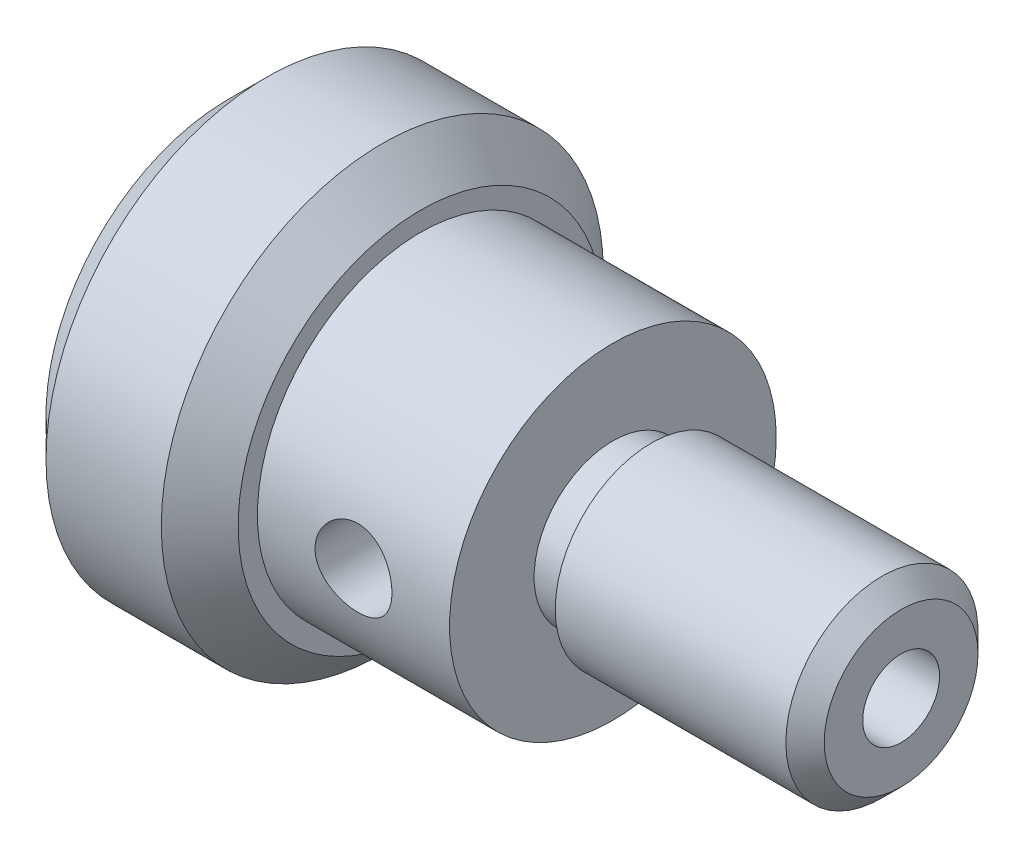
from build123d import *

# Parameters (mm, degrees)
SKETCH_1_R               = 11.5
EXTRUDE_1_DEPTH          = 10
CHAMFER_1_SIZE           = 2
CHAMFER_2_SIZE           = 2
SKETCH_2_R               = 8.5
EXTRUDE_2_DEPTH          = 10
SKETCH_3_R               = 4.1
EXTRUDE_3_DEPTH          = 2
SKETCH_4_R               = 5
EXTRUDE_4_DEPTH          = 13
CHAMFER_3_SIZE           = 1
CUT_EXTRUDE_1_DEPTH      = 39.594040991
CUT_EXTRUDE_1_DEPTH_BACK = 39.594040991
SKETCH_5_R               = 2
CUT_EXTRUDE_2_DEPTH      = 39.594040991
CUT_EXTRUDE_2_DEPTH_BACK = 23
SKETCH_6_R               = 2


with BuildPart() as part:
    # 草图1 → 凸台-拉伸1 (new body)
    with BuildSketch(Plane(origin=(0, 0, 0), x_dir=(0, 0, -1), z_dir=(1, 0, 0))):
        Circle(SKETCH_1_R)
    extrude(amount=EXTRUDE_1_DEPTH)

    # 倒角1
    chamfer_1_edges = [part.edges().sort_by_distance(p)[0] for p in [
        (0, 0, 11.5),
    ]]
    chamfer(chamfer_1_edges, length=CHAMFER_1_SIZE)

    # 倒角2
    chamfer_2_edges = [part.edges().sort_by_distance(p)[0] for p in [
        (10, 0, 11.5),
    ]]
    chamfer(chamfer_2_edges, length=CHAMFER_2_SIZE)

    # 草图2 → 凸台-拉伸2 (add)
    with BuildSketch(Plane(origin=(10, 0, 0), x_dir=(0, 0, -1), z_dir=(1, 0, 0))):
        Circle(SKETCH_2_R)
    extrude(amount=EXTRUDE_2_DEPTH)

    # 草图3 → 凸台-拉伸3 (add)
    with BuildSketch(Plane(origin=(20, 0, 0), x_dir=(0, 0, -1), z_dir=(1, 0, 0))):
        Circle(SKETCH_3_R)
    extrude(amount=EXTRUDE_3_DEPTH)

    # 草图4 → 凸台-拉伸4 (add)
    with BuildSketch(Plane(origin=(22, 0, 0), x_dir=(0, 0, -1), z_dir=(1, 0, 0))):
        Circle(SKETCH_4_R)
    extrude(amount=EXTRUDE_4_DEPTH)

    # 倒角3
    chamfer_3_edges = [part.edges().sort_by_distance(p)[0] for p in [
        (35, 0, 5),
    ]]
    chamfer(chamfer_3_edges, length=CHAMFER_3_SIZE)

    # 草图5 → 切除-拉伸1 (cut, two sides: drawn at the far end of the back side and taken through both)
    with BuildSketch(Plane.XY.offset(-CUT_EXTRUDE_1_DEPTH_BACK)):
        with Locations((15, 0)):
            Circle(SKETCH_5_R)
    extrude(amount=CUT_EXTRUDE_1_DEPTH + CUT_EXTRUDE_1_DEPTH_BACK, mode=Mode.SUBTRACT)

    # 草图6 → 切除-拉伸2 (cut, two sides: drawn at the far end of the back side and taken through both)
    with BuildSketch(Plane(origin=(35, 0, 0), x_dir=(0, 0, -1), z_dir=(1, 0, 0)).offset(-CUT_EXTRUDE_2_DEPTH_BACK)):
        Circle(SKETCH_6_R)
    extrude(amount=CUT_EXTRUDE_2_DEPTH + CUT_EXTRUDE_2_DEPTH_BACK, mode=Mode.SUBTRACT)


solid = part.part
